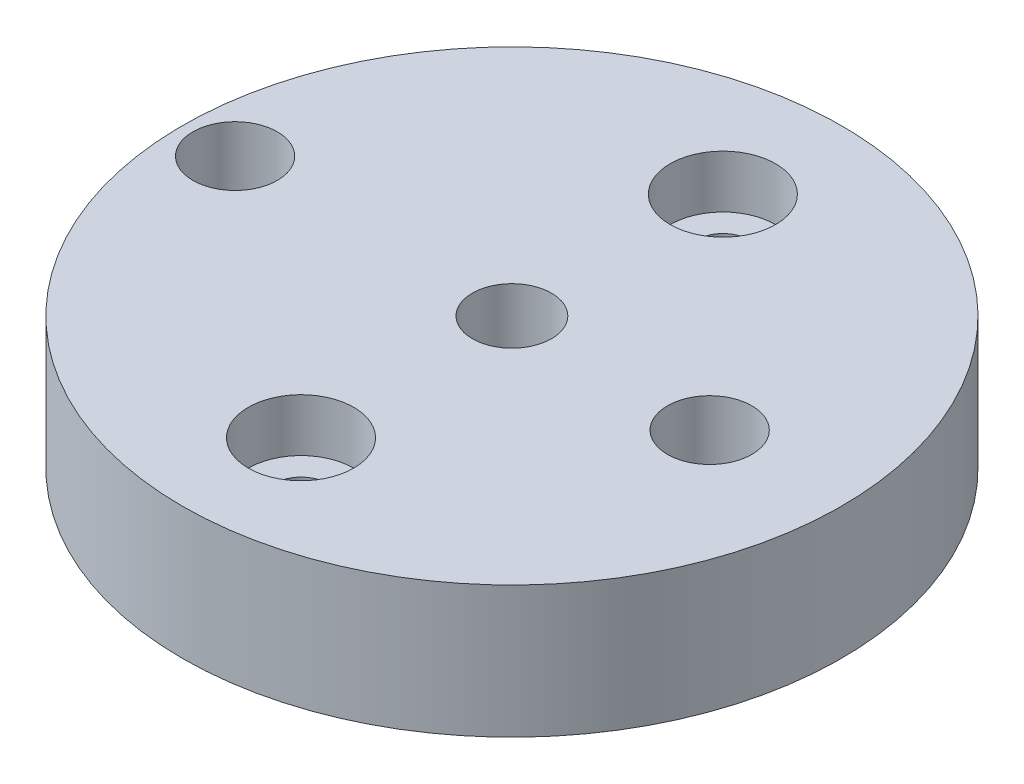
from build123d import *

# Parameters (mm, degrees)
SKETCH1_R           = 12.5
SKETCH1_R_2         = 1
SKETCH1_R_3         = 1.5
SKETCH1_R_4         = 1.6
BOSS_EXTRUDE1_DEPTH = 5
SKETCH2_R           = 2
CUT_EXTRUDE1_DEPTH  = 2


with BuildPart() as part:
    # Sketch1 → Boss-Extrude1 (new body)
    with BuildSketch(Plane(origin=(0, 0, 0), x_dir=(1, 0, 0), z_dir=(0, 1, 0))):
        with Locations(Location((0, 0, 0), (0, 0, 270))):
            Circle(SKETCH1_R)
        with Locations(Location((0, -8, 0), (0, 0, 270))):
            Circle(SKETCH1_R_2, mode=Mode.SUBTRACT)
        with Locations(Location((0, 8, 0), (0, 0, 270))):
            Circle(SKETCH1_R_2, mode=Mode.SUBTRACT)
        with Locations(Location((0, 0, 0), (0, 0, 270))):
            Circle(SKETCH1_R_3, mode=Mode.SUBTRACT)
        with Locations(Location((-10.5, 0, 0), (0, 0, 270))):
            Circle(SKETCH1_R_4, mode=Mode.SUBTRACT)
        with Locations(Location((7.5, 0, 0), (0, 0, 270))):
            Circle(SKETCH1_R_4, mode=Mode.SUBTRACT)
    extrude(amount=BOSS_EXTRUDE1_DEPTH)

    # Sketch2 → Cut-Extrude1 (cut)
    with BuildSketch(Plane(origin=(0, 5, 0), x_dir=(1, 0, 0), z_dir=(0, 1, 0))):
        with Locations(Location((0, 8, 0), (0, 0, 270))):
            Circle(SKETCH2_R)
        with Locations(Location((0, -8, 0), (0, 0, 270))):
            Circle(SKETCH2_R)
    extrude(amount=-CUT_EXTRUDE1_DEPTH, mode=Mode.SUBTRACT)


solid = part.part
